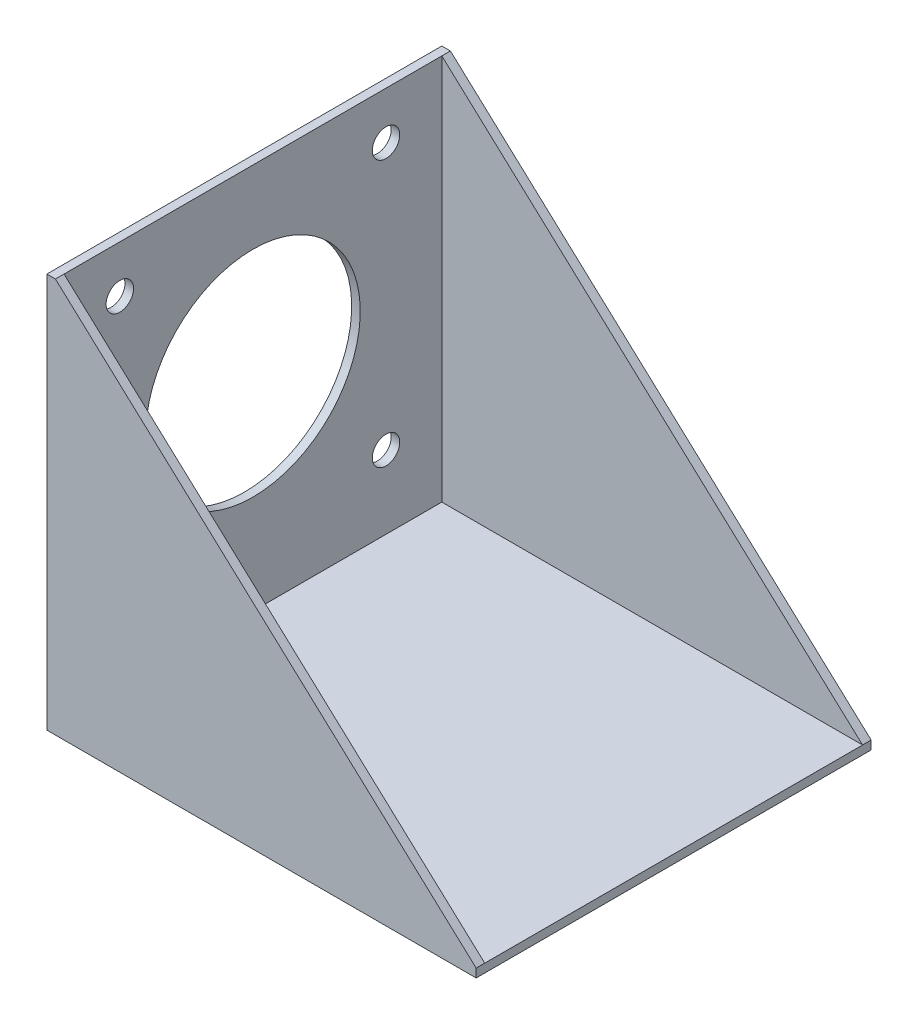
from build123d import *

# Parameters (mm, degrees)
EXTRUDE_1_DEPTH     = 46
EXTRUDE_2_DEPTH     = 1
EXTRUDE_3_DEPTH     = 1
SKETCH_5_R          = 1.6
SKETCH_5_R_2        = 12.5
CUT_EXTRUDE_1_DEPTH = 1


with BuildPart() as part:
    # 草图2 → 凸台-拉伸1 (new body)
    with BuildSketch(Plane.XY):
        Polygon((0, 46), (0, 0), (50, 0), (50, 1), (1, 1), (1, 46), align=None)
    extrude(amount=EXTRUDE_1_DEPTH)

    # 草图3 → 凸台-拉伸2 (add)
    with BuildSketch(Plane.XY.offset(46)):
        Polygon((1, 46), (50, 1), (1, 1), align=None)
    extrude(amount=-EXTRUDE_2_DEPTH)

    # 草图4 → 凸台-拉伸3 (add)
    with BuildSketch(Plane(origin=(0, 0, 0), x_dir=(-1, 0, 0), z_dir=(0, 0, -1))):
        Polygon((-1, 46), (-50, 1), (-1, 1), align=None)
    extrude(amount=-EXTRUDE_3_DEPTH)

    # 草图5 → 切除-拉伸1 (cut)
    with BuildSketch(Plane.ZY):
        with Locations(Location((7.5, 40.5, 0), (0, 0, 270))):
            Circle(SKETCH_5_R)
        with Locations(Location((38.5, 40.5, 0), (0, 0, 90))):
            Circle(SKETCH_5_R)
        with Locations(Location((7.5, 9.5, 0), (0, 0, 270))):
            Circle(SKETCH_5_R)
        with Locations(Location((38.5, 9.5, 0), (0, 0, 90))):
            Circle(SKETCH_5_R)
        with Locations(Location((23, 25, 0), (0, 0, 270))):
            Circle(SKETCH_5_R_2)
    extrude(amount=-CUT_EXTRUDE_1_DEPTH, mode=Mode.SUBTRACT)


solid = part.part
